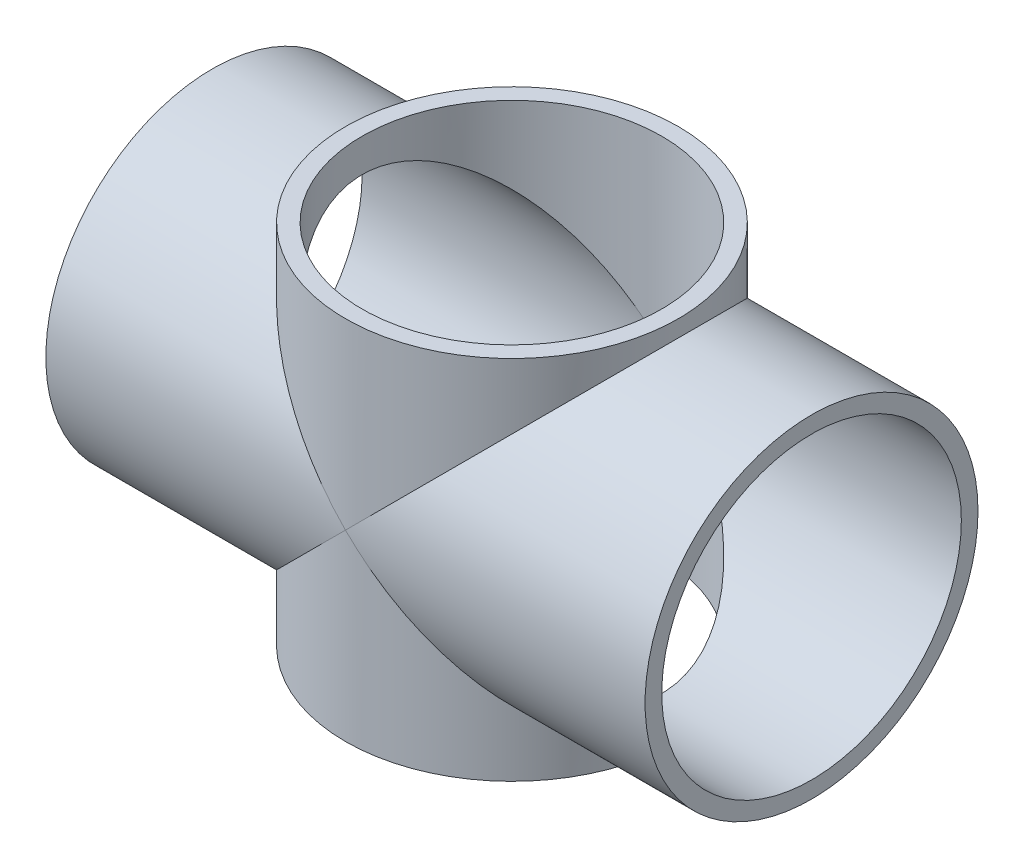
from build123d import *
from build123d.topology import SkipClean

# Parameters (mm, degrees)
SKETCH2_R                = 63.5
SKETCH2_R_2              = 57.15
BOSS_EXTRUDE1_DEPTH      = 228.6
BOSS_EXTRUDE2_DEPTH      = 114.3
BOSS_EXTRUDE2_DEPTH_BACK = 114.3
SKETCH3_R                = 63.5
SKETCH3_R_2              = 57.15
SKETCH4_R                = 57.15
CUT_EXTRUDE1_DEPTH       = 330.466493124
SKETCH5_R                = 57.15
CUT_EXTRUDE2_DEPTH       = 264.352805317
CUT_EXTRUDE3_DEPTH       = 264.352805317
CUT_EXTRUDE3_DEPTH_BACK  = 264.352805317
SKETCH6_W                = 187.910276351
SKETCH6_H                = 55.092106145
SKETCH6_W_2              = 179.956402219
SKETCH6_H_2              = 52.109403346


with BuildPart() as part:
    # Sketch2 → Boss-Extrude1 (new body)
    with BuildSketch(Plane(origin=(0, 0, 0), x_dir=(1, 0, 0), z_dir=(0, 1, 0))):
        Circle(SKETCH2_R)
        Circle(SKETCH2_R_2, mode=Mode.SUBTRACT)
    extrude(amount=BOSS_EXTRUDE1_DEPTH)

    # Sketch3 → Boss-Extrude2 (add, two sides: drawn at the far end of the back side and taken through both)
    with BuildSketch(Plane(origin=(0, 0, 0), x_dir=(0, 0, -1), z_dir=(1, 0, 0)).offset(-BOSS_EXTRUDE2_DEPTH_BACK)):
        with Locations((0, 114.3)):
            Circle(SKETCH3_R)
        with Locations((0, 114.3)):
            Circle(SKETCH3_R_2, mode=Mode.SUBTRACT)
    extrude(amount=BOSS_EXTRUDE2_DEPTH + BOSS_EXTRUDE2_DEPTH_BACK)

    # Sketch4 → Cut-Extrude1 (cut, through all)
    with BuildSketch(Plane.ZY.offset(114.3)):
        with Locations((0, 114.3)):
            Circle(SKETCH4_R)
    extrude(amount=-CUT_EXTRUDE1_DEPTH, mode=Mode.SUBTRACT)

    # Sketch5 → Cut-Extrude2 (cut, through all)
    with SkipClean():  # the faces are left unmerged after this step: merging them gives an invalid solid
        with BuildSketch(Plane(origin=(0, 228.6, 0), x_dir=(1, 0, 0), z_dir=(0, 1, 0))):
            Circle(SKETCH5_R)
        extrude(amount=-CUT_EXTRUDE2_DEPTH, mode=Mode.SUBTRACT)

    # Sketch6 → Cut-Extrude3 (cut, two sides: drawn at the far end of the back side and taken through both)
    with SkipClean():  # the faces are left unmerged after this step: merging them gives an invalid solid
        with BuildSketch(Plane(origin=(0, 0, 0), x_dir=(0, 0, -1), z_dir=(1, 0, 0)).offset(-CUT_EXTRUDE3_DEPTH_BACK)):
            with Locations((10.108048375, 211.696053073)):
                Rectangle(SKETCH6_W, SKETCH6_H)
            with Locations((6.131111309, 18.395298327)):
                Rectangle(SKETCH6_W_2, SKETCH6_H_2)
        extrude(amount=CUT_EXTRUDE3_DEPTH + CUT_EXTRUDE3_DEPTH_BACK, mode=Mode.SUBTRACT)


solid = part.part
